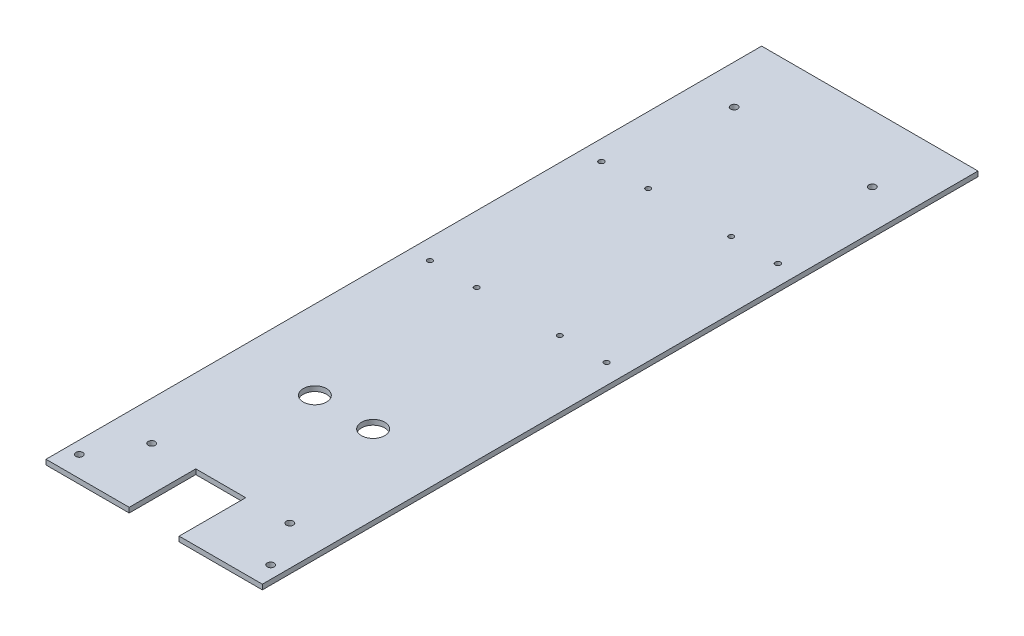
from build123d import *

# Parameters (mm, degrees)
SKETCH1_W           = 130
SKETCH1_H           = 430
BOSS_EXTRUDE1_DEPTH = 3
SKETCH2_W           = 30
SKETCH2_H           = 40
CUT_EXTRUDE1_DEPTH  = 10
SKETCH3_R           = 1.5
SKETCH3_R_2         = 1.6
SKETCH3_R_3         = 2.1
CUT_EXTRUDE2_DEPTH  = 10
SKETCH4_R           = 7
CUT_EXTRUDE3_DEPTH  = 10


with BuildPart() as part:
    # Sketch1 → Boss-Extrude1 (new body)
    with BuildSketch(Plane(origin=(0, 0, 0), x_dir=(1, 0, 0), z_dir=(0, 1, 0))):
        Rectangle(SKETCH1_W, SKETCH1_H)
    extrude(amount=BOSS_EXTRUDE1_DEPTH)

    # Sketch2 → Cut-Extrude1 (cut)
    with BuildSketch(Plane(origin=(0, 3, 0), x_dir=(1, 0, 0), z_dir=(0, 1, 0))):
        with Locations((0, -195)):
            Rectangle(SKETCH2_W, SKETCH2_H)
    extrude(amount=-CUT_EXTRUDE1_DEPTH, mode=Mode.SUBTRACT)

    # Sketch3 → Cut-Extrude2 (cut)
    with BuildSketch(Plane.XZ):
        with Locations(Location((-53.05, -3.75, 0), (0, 0, 270))):
            Circle(SKETCH3_R)
        with Locations(Location((-24.95, -3.75, 0), (0, 0, 270))):
            Circle(SKETCH3_R)
        with Locations(Location((-53.05, -106.75, 0), (0, 0, 270))):
            Circle(SKETCH3_R_2)
        with Locations(Location((-24.95, -106.75, 0), (0, 0, 270))):
            Circle(SKETCH3_R)
        with Locations(Location((24.95, -106.75, 0), (0, 0, 90))):
            Circle(SKETCH3_R)
        with Locations(Location((57.5, 202.5, 0), (0, 0, 270))):
            Circle(SKETCH3_R_3)
        with Locations(Location((53.05, -106.75, 0), (0, 0, 90))):
            Circle(SKETCH3_R_2)
        with Locations(Location((24.95, -3.75, 0), (0, 0, 90))):
            Circle(SKETCH3_R)
        with Locations(Location((-57.5, 202.5, 0), (0, 0, 270))):
            Circle(SKETCH3_R_3)
        with Locations(Location((53.05, -3.75, 0), (0, 0, 90))):
            Circle(SKETCH3_R)
        with Locations(Location((-41.5, 175, 0), (0, 0, 270))):
            Circle(SKETCH3_R_3)
        with Locations(Location((41.5, 175, 0), (0, 0, 270))):
            Circle(SKETCH3_R_3)
        with Locations(Location((41.5, -175, 0), (0, 0, 270))):
            Circle(SKETCH3_R_3)
        with Locations(Location((-41.5, -175, 0), (0, 0, 270))):
            Circle(SKETCH3_R_3)
    extrude(amount=-CUT_EXTRUDE2_DEPTH, mode=Mode.SUBTRACT)

    # Sketch4 → Cut-Extrude3 (cut)
    with BuildSketch(Plane.XZ):
        with Locations(Location((-17.5, 100.952208061, 0), (0, 0, 270))):
            Circle(SKETCH4_R)
        with Locations(Location((17.5, 100.952208061, 0), (0, 0, 270))):
            Circle(SKETCH4_R)
    extrude(amount=-CUT_EXTRUDE3_DEPTH, mode=Mode.SUBTRACT)


solid = part.part
